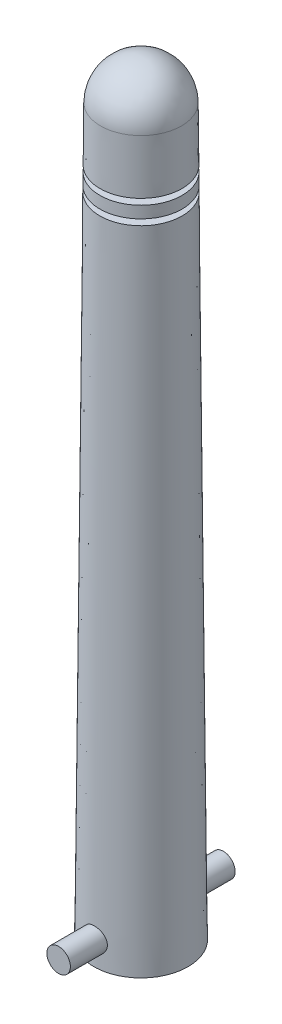
from build123d import *

# Parameters (mm, degrees)
ESQUISSE2_R      = 1
EXTRUSION1_DEPTH = 7


with BuildPart() as part:
    # Esquisse1 → Révolution1 (revolve)
    with BuildSketch(Plane.XY, mode=Mode.PRIVATE) as r_volution1_sk:
        with BuildLine():
            Line((0, 0), (4, 0))
            Line((4, 0), (3.5, 55))
            Line((3.5, 55), (2.5, 55))
            Line((2.5, 55), (2.5, 55.5))
            Line((2.5, 55.5), (3.495454545, 55.5))
            Line((3.495454545, 55.5), (3.486363636, 56.5))
            Line((3.486363636, 56.5), (2.486363636, 56.5))
            Line((2.486363636, 56.5), (2.486363636, 57))
            Line((2.486363636, 57), (3.481818182, 57))
            Line((3.481818182, 57), (3.440081364, 61.591049954))
            ThreePointArc((3.440081364, 61.591049954), (2.421523292, 64.003413687), (0, 65))
            Line((0, 65), (0, 0))
        make_face()
    revolve(r_volution1_sk.sketch.rotate(Axis((0, 0, 0), (0, 1, 0)), 90), axis=Axis((0, 0, 0), (0, 1, 0)))

    # Esquisse2 → Extrusion1 (add, symmetric)
    with BuildSketch(Plane.XY):
        with Locations(Location((0, 2, 0), (0, 0, 222.556975448))):
            Circle(ESQUISSE2_R)
    extrude(amount=EXTRUSION1_DEPTH, both=True)


solid = part.part
